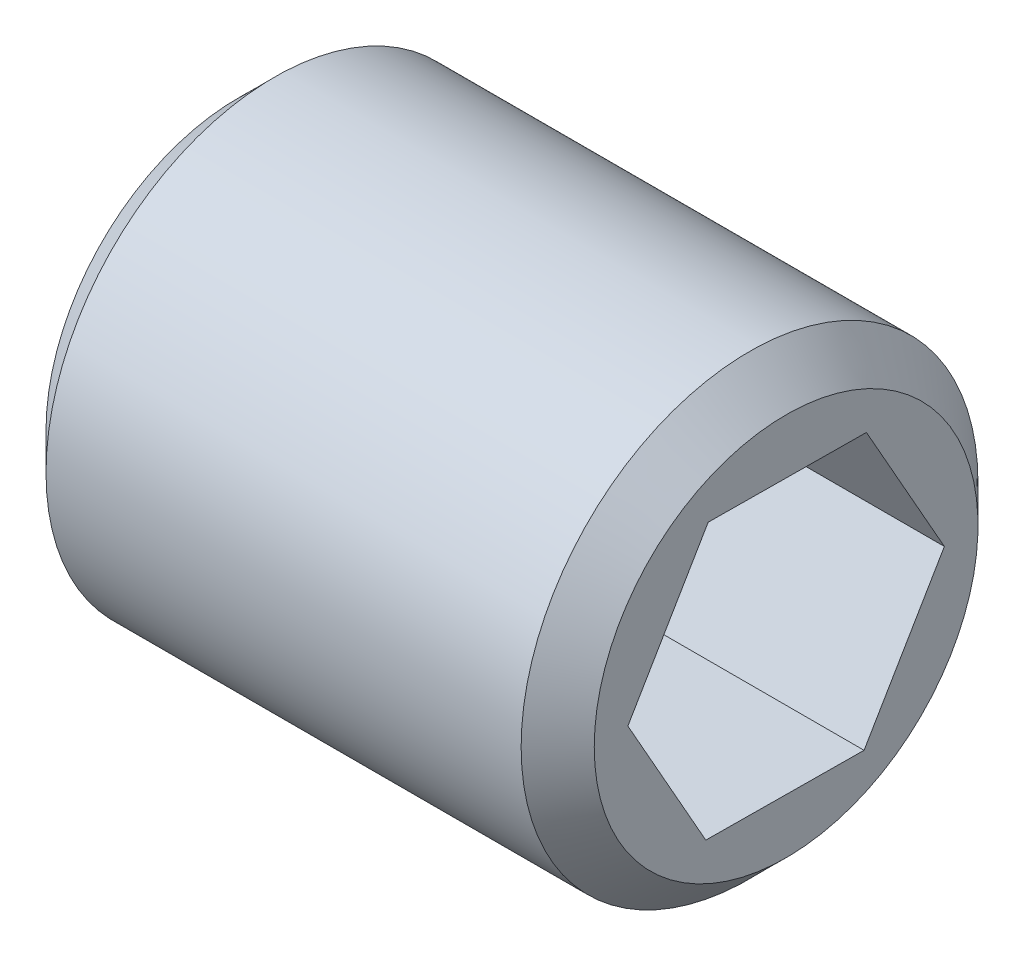
from build123d import *

# Parameters (mm, degrees)
ENL_V_MAT_EXTRU_1_DEPTH = 1.5


with BuildPart() as part:
    # Esquisse1 → Révolution1 (revolve)
    with BuildSketch(Plane.XY, mode=Mode.PRIVATE) as r_volution1_sk:
        Polygon((-3, 0), (-3, 1.05), (-2.8, 1.25), (-0.2, 1.25), (0, 1.05), (0, 0), align=None)
    revolve(r_volution1_sk.sketch.rotate(Axis((-47.127645023, 0, 0), (1, 0, 0)), 90), axis=Axis((-47.127645023, 0, 0), (1, 0, 0)))

    # Esquisse2 → Enlèv. mat.-Extru.1 (cut)
    with BuildSketch(Plane(origin=(0, 0, 0), x_dir=(0, 0, -1), z_dir=(1, 0, 0))):
        Polygon((0.439447908, 0.746247638), (-0.426545458, 0.75369687), (-0.865993365, 0.007449233), (-0.439447908, -0.746247638), (0.426545458, -0.75369687), (0.865993365, -0.007449233), align=None)
    extrude(amount=-ENL_V_MAT_EXTRU_1_DEPTH, mode=Mode.SUBTRACT)


solid = part.part
